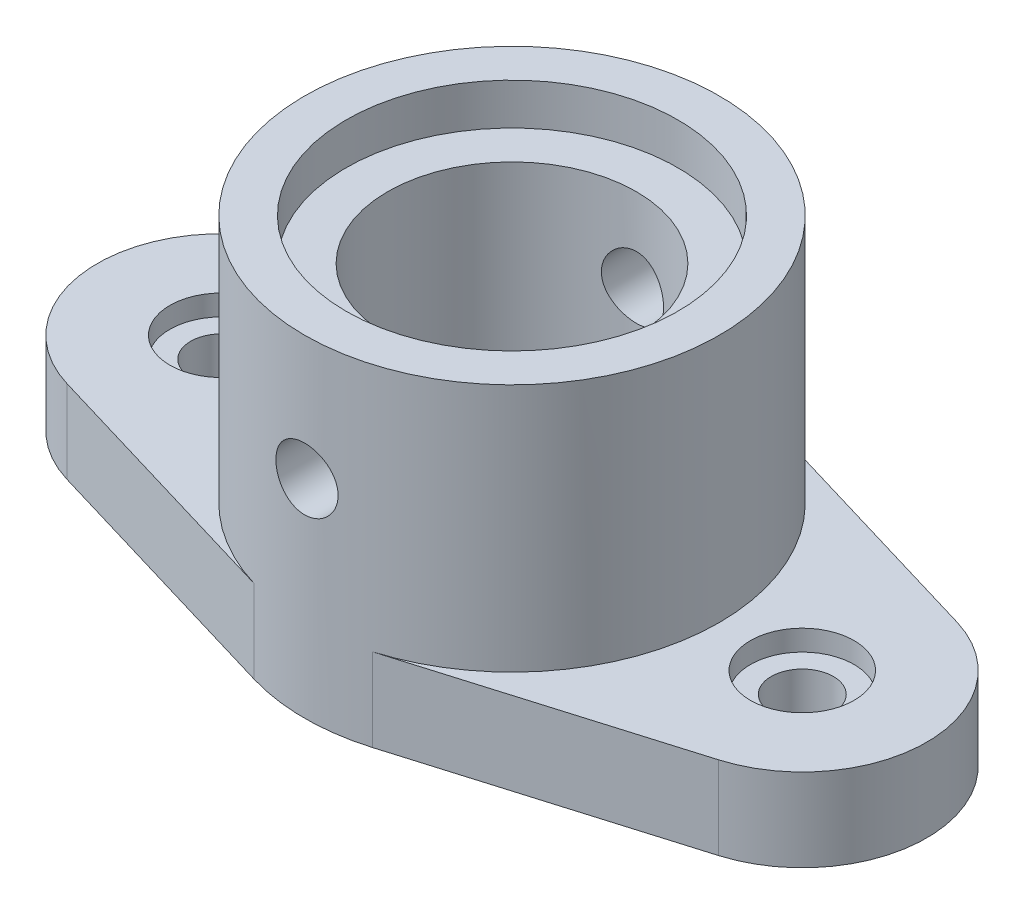
from build123d import *

# Parameters (mm, degrees)
SKETCH1_R                    = 31.75
SKETCH1_R_2                  = 19.05
BOSS_EXTRUDE1_DEPTH          = 12.7
SKETCH2_R                    = 31.75
SKETCH2_R_2                  = 19.05
BOSS_EXTRUDE2_DEPTH          = 38.1
SKETCH3_R                    = 25.4
CUT_EXTRUDE1_DEPTH           = 6.35
HOLE1_D                      = 9.525
HOLE1_DEPTH                  = 12.7
HOLE1_CBORE_D                = 15.875
HOLE1_CBORE_DEPTH            = 3.175
HOLE1_TIP                    = 2.861598698
F_3_8_0_375_DIAMETER_HOLE1_D = 9.525


with BuildPart() as part:
    # Sketch1 → Boss-Extrude1 (new body)
    # profile 1 of 3: a face of its own
    with BuildSketch(Plane(origin=(0, 0, 0), x_dir=(1, 0, 0), z_dir=(0, 1, 0))):
        with BuildLine():
            Line((-9.071428571, 30.426496408), (-49.892857143, 18.255897845))
            ThreePointArc((-49.892857143, 18.255897845), (-63.5, 0), (-49.892857143, -18.255897845))
            Line((-49.892857143, -18.255897845), (-9.071428571, -30.426496408))
            ThreePointArc((-9.071428571, -30.426496408), (-31.75, 0), (-9.071428571, 30.426496408))
        make_face()
    # profile 2 of 3: a face of its own
    with BuildSketch(Plane(origin=(0, 0, 0), x_dir=(1, 0, 0), z_dir=(0, 1, 0))):
        Circle(SKETCH1_R)
        with Locations(Location((0, 0, 0), (0, 0, 270))):
            Circle(SKETCH1_R_2, mode=Mode.SUBTRACT)
    # profile 3 of 3: a face of its own
    with BuildSketch(Plane(origin=(0, 0, 0), x_dir=(1, 0, 0), z_dir=(0, 1, 0))):
        with BuildLine():
            Line((49.892857143, 18.255897845), (9.071428571, 30.426496408))
            ThreePointArc((9.071428571, 30.426496408), (25.456633292, 18.974254173), (31.75, 0))
            ThreePointArc((31.75, 0), (25.456633292, -18.974254173), (9.071428571, -30.426496408))
            Line((9.071428571, -30.426496408), (49.892857143, -18.255897845))
            ThreePointArc((49.892857143, -18.255897845), (63.5, 0), (49.892857143, 18.255897845))
        make_face()
    extrude(amount=BOSS_EXTRUDE1_DEPTH)

    # Sketch2 → Boss-Extrude2 (add)
    with BuildSketch(Plane(origin=(0, 12.7, 0), x_dir=(1, 0, 0), z_dir=(0, 1, 0))):
        with Locations(Location((0, 0, 0), (0, 0, 106.601549599))):
            Circle(SKETCH2_R)
        with Locations(Location((0, 0, 0), (0, 0, 270))):
            Circle(SKETCH2_R_2, mode=Mode.SUBTRACT)
    extrude(amount=BOSS_EXTRUDE2_DEPTH)

    # Sketch3 → Cut-Extrude1 (cut)
    with BuildSketch(Plane(origin=(0, 50.8, 0), x_dir=(1, 0, 0), z_dir=(0, 1, 0))):
        with Locations(Location((0, 0, 0), (0, 0, 270))):
            Circle(SKETCH3_R)
    extrude(amount=-CUT_EXTRUDE1_DEPTH, mode=Mode.SUBTRACT)

    # Hole1
    with Locations(Plane(origin=(0, 12.7, 0), x_dir=(1, 0, 0), z_dir=(0, 1, 0))):
        with Locations((-44.45, 0), (44.45, 0)):
            CounterBoreHole(HOLE1_D / 2, HOLE1_CBORE_D / 2, HOLE1_CBORE_DEPTH, depth=HOLE1_DEPTH)
            with Locations((0, 0, -(HOLE1_DEPTH + HOLE1_TIP / 2))):  # 118° drill point
                Cone(0, HOLE1_D / 2, HOLE1_TIP, mode=Mode.SUBTRACT)

    # 3/8 (0.375) Diameter Hole1 (through all)
    with Locations(Plane(origin=(0, 31.75, -31.75), x_dir=(-1, 0, 0), z_dir=(0, 0, -1))):
        with Locations((0, 0)):
            Hole(F_3_8_0_375_DIAMETER_HOLE1_D / 2)


solid = part.part
